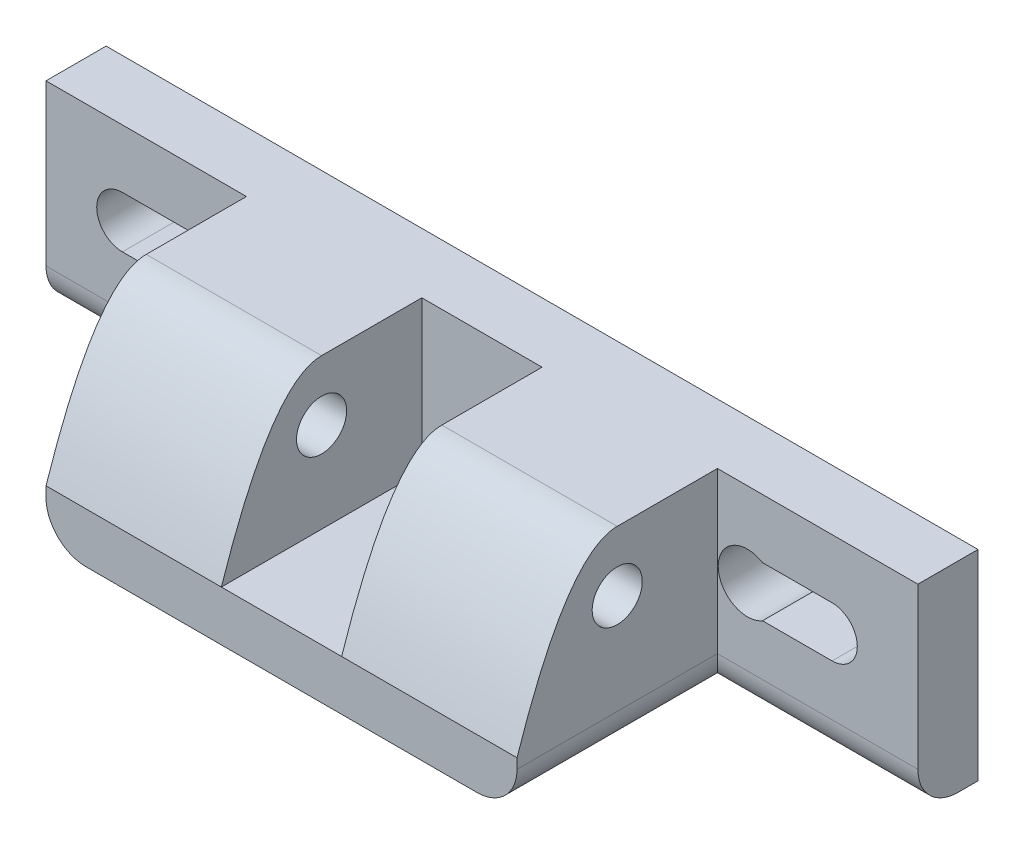
from build123d import *

# Parameters (mm, degrees)
SKETCH1_W           = 59.69
SKETCH1_H           = 25.4
BOSS_EXTRUDE1_DEPTH = 25.4
SKETCH2_W           = 15.24
SKETCH2_H           = 25.4
CUT_EXTRUDE1_DEPTH  = 19.05
SKETCH3_R           = 3.175
CUT_EXTRUDE2_DEPTH  = 67.101029493
SKETCH5_W           = 110.49
SKETCH5_H           = 25.4
BOSS_EXTRUDE2_DEPTH = 7.62
CUT_EXTRUDE4_DEPTH  = 92.095392309
CUT_EXTRUDE5_DEPTH  = 70.191693408
FILLET2_R           = 5.08
FILLET3_R           = 2.54


with BuildPart() as part:
    # Sketch1 → Boss-Extrude1 (new body)
    with BuildSketch(Plane(origin=(0, 0, 0), x_dir=(1, 0, 0), z_dir=(0, 1, 0))):
        Rectangle(SKETCH1_W, SKETCH1_H)
    extrude(amount=BOSS_EXTRUDE1_DEPTH)

    # Sketch2 → Cut-Extrude1 (cut)
    with BuildSketch(Plane(origin=(0, 25.4, 0), x_dir=(1, 0, 0), z_dir=(0, 1, 0))):
        Rectangle(SKETCH2_W, SKETCH2_H)
    extrude(amount=-CUT_EXTRUDE1_DEPTH, mode=Mode.SUBTRACT)

    # Sketch3 → Cut-Extrude2 (cut, through all)
    with BuildSketch(Plane.ZY.offset(29.845)):
        with Locations((0, 17.78)):
            Circle(SKETCH3_R)
    extrude(amount=-CUT_EXTRUDE2_DEPTH, mode=Mode.SUBTRACT)

    # Sketch5 → Boss-Extrude2 (add)
    with BuildSketch(Plane(origin=(0, 0, -12.7), x_dir=(-1, 0, 0), z_dir=(0, 0, -1))):
        with Locations((0, 12.7)):
            Rectangle(SKETCH5_W, SKETCH5_H)
    extrude(amount=BOSS_EXTRUDE2_DEPTH)

    # Sketch4 → Cut-Extrude4 (cut, through all)
    with BuildSketch(Plane(origin=(29.845, 0, 0), x_dir=(0, 0, -1), z_dir=(1, 0, 0))):
        with BuildLine():
            Line((-12.7, 6.35), (-12.7, 25.4))
            Line((-12.7, 25.4), (0, 25.4))
            add(Edge.make_bspline(
                [(-12.7, 6.35), (-6.35, 25.4), (0, 25.4)],
                knots=[0, 0, 0, 0.5, 0.5, 0.5], degree=2))
        make_face()
    extrude(amount=-CUT_EXTRUDE4_DEPTH, mode=Mode.SUBTRACT)

    # Sketch6 → Cut-Extrude5 (cut, through all)
    with BuildSketch(Plane(origin=(0, 0, -20.32), x_dir=(-1, 0, 0), z_dir=(0, 0, -1))):
        with BuildLine():
            Line((-44.37743079, 17.921542216), (-35.56, 17.921542216))
            ThreePointArc((-35.56, 17.921542216), (-29.939868166, 14.732), (-35.56, 11.542457784))
            Line((-35.56, 11.542457784), (-44.37743079, 11.542457784))
            ThreePointArc((-44.37743079, 11.542457784), (-47.566973006, 14.732), (-44.37743079, 17.921542216))
        make_face()
        with BuildLine():
            Line((35.56, 17.994815174), (45.556129925, 17.994815174))
            ThreePointArc((45.556129925, 17.994815174), (48.818945099, 14.732), (45.556129925, 11.469184826))
            Line((45.556129925, 11.469184826), (35.56, 11.469184826))
            ThreePointArc((35.56, 11.469184826), (29.876774509, 14.732), (35.56, 17.994815174))
        make_face()
    extrude(amount=-CUT_EXTRUDE5_DEPTH, mode=Mode.SUBTRACT)

    # Fillet2
    fillet2_edges = [part.edges().sort_by_distance(p)[0] for p in [
        (42.545, 0, -12.7),
        (-42.545, 0, -12.7),
        (29.845, 0, 0),
        (-29.845, 0, 0),
    ]]
    fillet(fillet2_edges, radius=FILLET2_R)

    # Fillet3
    fillet3_edges = [part.edges().sort_by_distance(p)[0] for p in [
        (0, 6.35, -12.7),
    ]]
    fillet(fillet3_edges, radius=FILLET3_R)


solid = part.part
